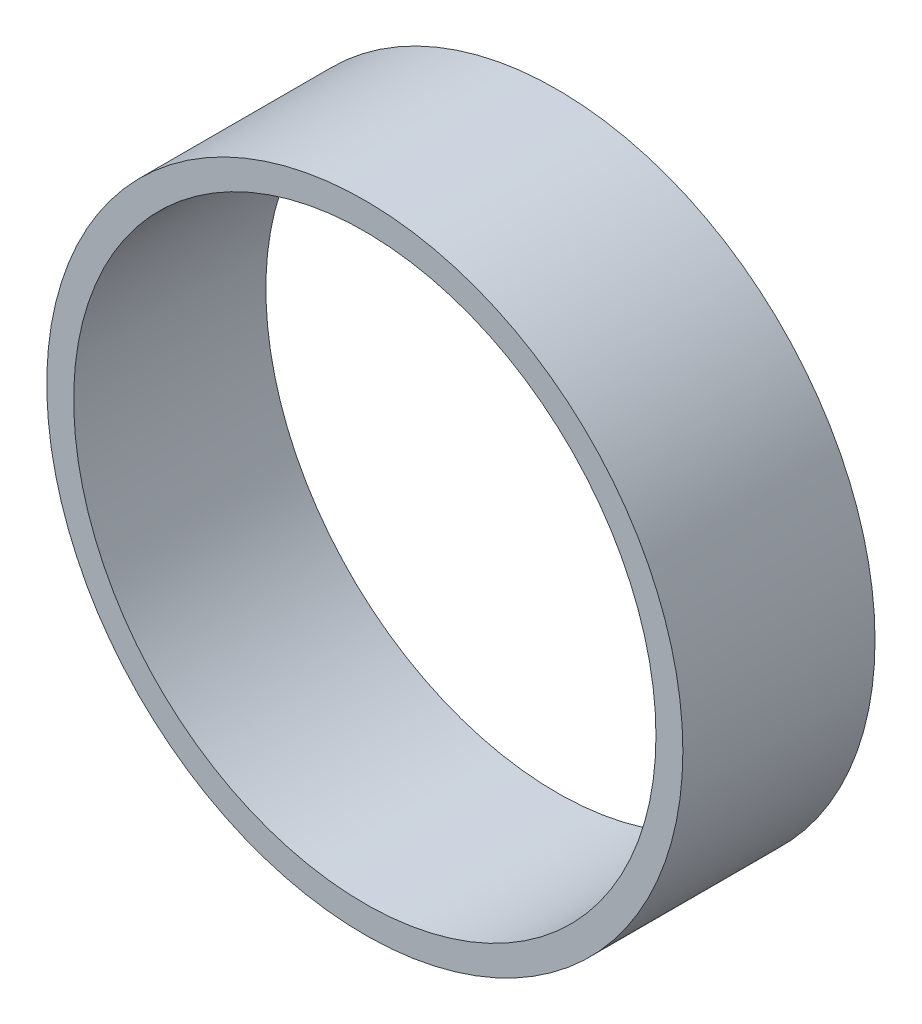
from build123d import *

# Parameters (mm, degrees)
PIPESKETCH_R    = 84.074
PIPESKETCH_R_2  = 76.962
EXTRUSION_DEPTH = 50.8


with BuildPart() as part:
    # PipeSketch → Extrusion (new body)
    with BuildSketch(Plane.XY):
        Circle(PIPESKETCH_R)
        Circle(PIPESKETCH_R_2, mode=Mode.SUBTRACT)
    extrude(amount=EXTRUSION_DEPTH)


solid = part.part
